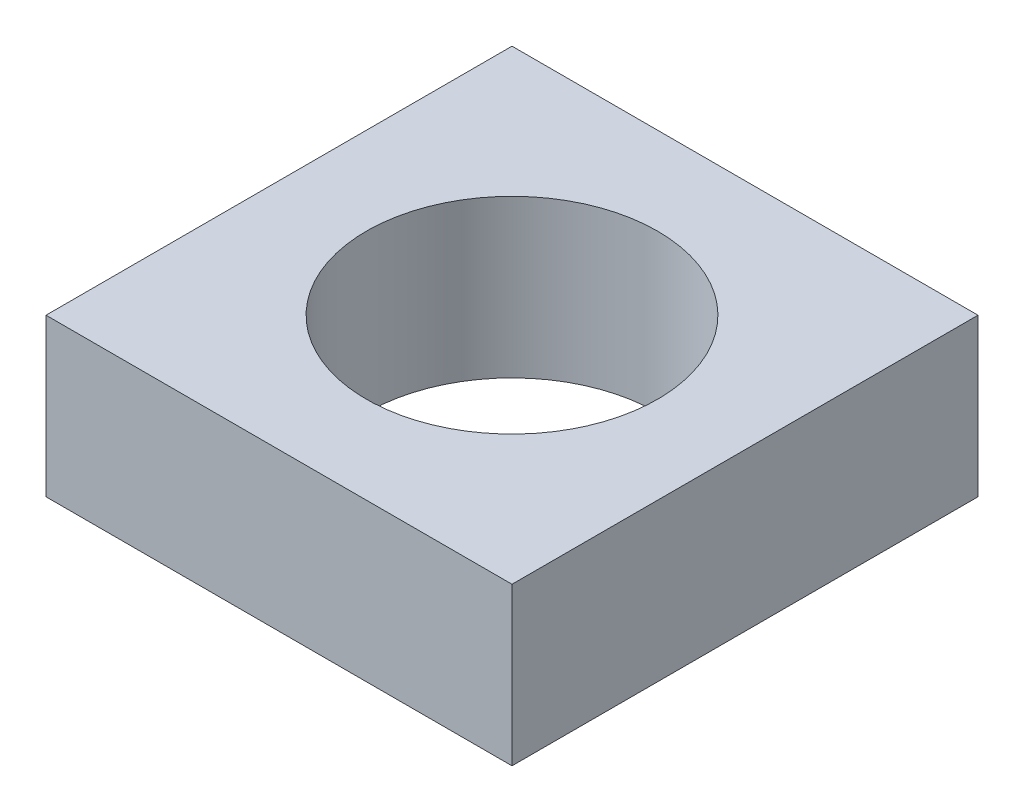
from build123d import *

# Parameters (mm, degrees)
SKETCH1_W           = 8
SKETCH1_H           = 8
SKETCH1_R           = 2.5
BOSS_EXTRUDE1_DEPTH = 1.35


with BuildPart() as part:
    # Sketch1 → Boss-Extrude1 (new, symmetric)
    with BuildSketch(Plane(origin=(0, 0, 0), x_dir=(1, 0, 0), z_dir=(0, 1, 0))):
        Rectangle(SKETCH1_W, SKETCH1_H)
        Circle(SKETCH1_R, mode=Mode.SUBTRACT)
    extrude(amount=BOSS_EXTRUDE1_DEPTH, both=True)


solid = part.part
